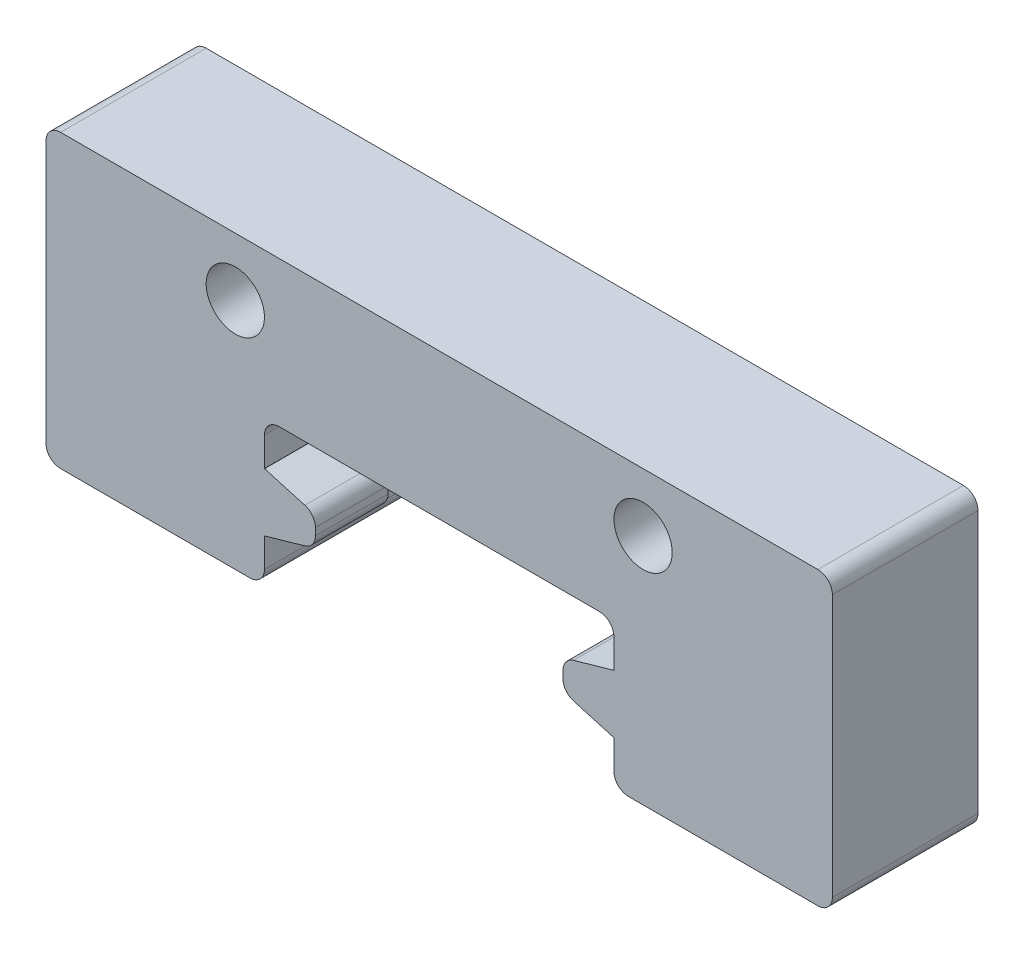
from build123d import *
from OCP.BRepFilletAPI import BRepFilletAPI_MakeChamfer

# Parameters (mm, degrees)
BOSS_EXTRUDE1_DEPTH = 5
CHAMFER1_SIZE       = 0.5
CHAMFER1_SIZE2      = 1.743707222
FILLET1_R           = 0.5
SKETCH2_R           = 1
CUT_EXTRUDE1_DEPTH  = 5
FILLET2_R           = 0.5
SKETCH4_W           = 6.75
SKETCH4_H           = 2.5
CUT_EXTRUDE2_DEPTH  = 2.5


with BuildPart() as part:
    # Sketch1 → Boss-Extrude1 (new body)
    with BuildSketch(Plane.XY):
        Polygon((-6, -1.5), (-6, 0), (6, 0), (6, -1.5), (4.25, -1.5), (4.25, -3.5), (6, -3.5), (6, -5), (13.5, -5), (13.5, 5), (-13.5, 5), (-13.5, -5), (-6, -5), (-6, -3.5), (-4.25, -3.5), (-4.25, -1.5), align=None)
    extrude(amount=BOSS_EXTRUDE1_DEPTH)

    # Chamfer1: one chamfer whose edges measure the first distance from different faces: ONE call of the kernel's chamfer builder (chamfer() names one face for all edges)
    chamfer1_edges_1 = [part.edges().sort_by_distance(p)[0] for p in [
        (4.25, -3.5, 2.5),
        (4.25, -1.5, 2.5),
    ]]
    chamfer1_side_1 = [part.faces().sort_by_distance(p)[0] for p in [
        (4.25, -2.5, 2.5),
    ]]
    chamfer1_edges_2 = [part.edges().sort_by_distance(p)[0] for p in [
        (-4.25, -1.5, 2.5),
        (-4.25, -3.5, 2.5),
    ]]
    chamfer1_side_2 = [part.faces().sort_by_distance(p)[0] for p in [
        (-4.25, -2.5, 2.5),
    ]]
    chamfer1 = BRepFilletAPI_MakeChamfer(part.part.solid().wrapped)
    for e in chamfer1_edges_1:
        chamfer1.Add(CHAMFER1_SIZE, CHAMFER1_SIZE2, e.wrapped, chamfer1_side_1[0].wrapped)  # the first distance lies on this face
    for e in chamfer1_edges_2:
        chamfer1.Add(CHAMFER1_SIZE, CHAMFER1_SIZE2, e.wrapped, chamfer1_side_2[0].wrapped)  # the first distance lies on this face
    add(Compound.cast(chamfer1.Shape()), mode=Mode.REPLACE)

    # Fillet1
    fillet1_edges = [part.edges().sort_by_distance(p)[0] for p in [
        (4.25, -2, 2.5),
        (4.25, -3, 2.5),
        (-4.25, -2, 2.5),
        (-4.25, -3, 2.5),
    ]]
    fillet(fillet1_edges, radius=FILLET1_R)

    # Sketch2 → Cut-Extrude1 (cut)
    with BuildSketch(Plane.XY.offset(5)):
        with Locations((-7, 3)):
            Circle(SKETCH2_R)
        with Locations((7, 3)):
            Circle(SKETCH2_R)
    extrude(amount=-CUT_EXTRUDE1_DEPTH, mode=Mode.SUBTRACT)

    # Fillet2
    fillet2_edges = [part.edges().sort_by_distance(p)[0] for p in [
        (6, -5, 2.5),
        (6, 0, 2.5),
        (-6, 0, 2.5),
        (-6, -5, 2.5),
        (-13.5, -5, 2.5),
        (-13.5, 5, 2.5),
        (13.5, 5, 2.5),
        (13.5, -5, 2.5),
    ]]
    fillet(fillet2_edges, radius=FILLET2_R)

    # Sketch4 → Cut-Extrude2 (cut)
    with BuildSketch(Plane(origin=(0, 0, 0), x_dir=(-1, 0, 0), z_dir=(0, 0, -1))):
        with Locations((-7.625, -2.5)):
            Rectangle(SKETCH4_W, SKETCH4_H)
        with Locations((7.625, -2.5)):
            Rectangle(SKETCH4_W, SKETCH4_H)
    extrude(amount=-CUT_EXTRUDE2_DEPTH, mode=Mode.SUBTRACT)


solid = part.part
